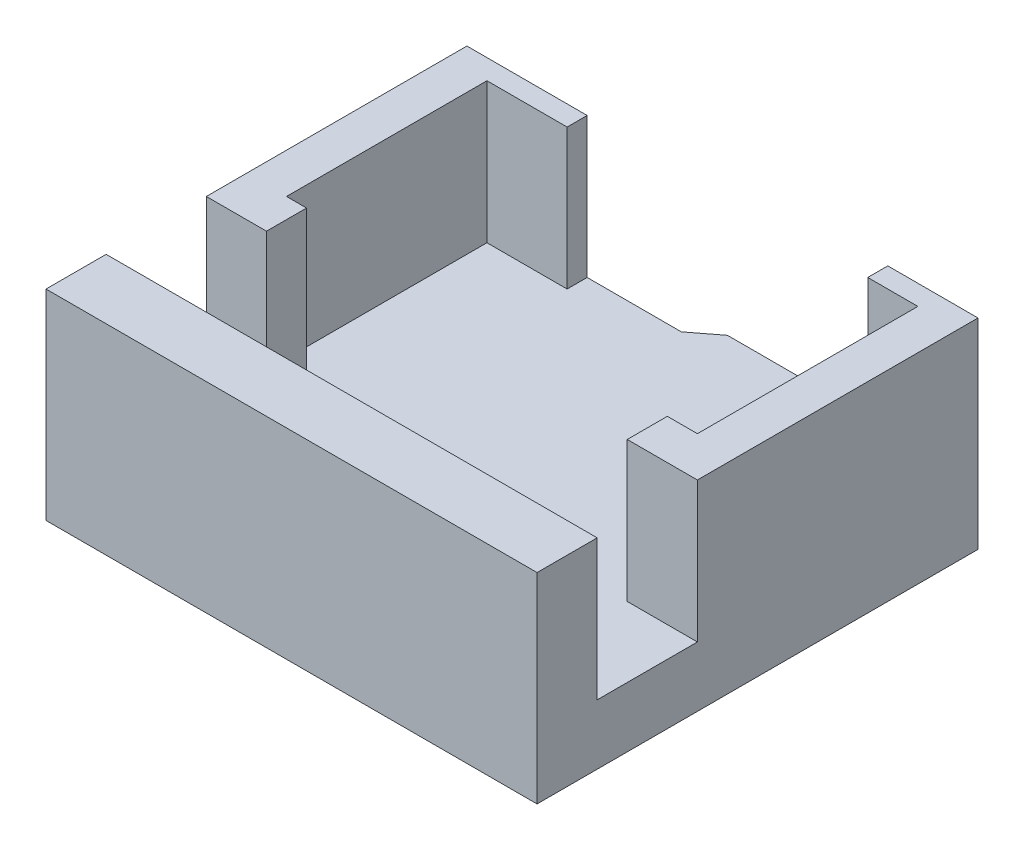
from build123d import *

# Parameters (mm, degrees)
BOSS_EXTRUDE1_DEPTH   = 7
BOSS_EXTRUDE1_2_DEPTH = 7
BOSS_EXTRUDE2_DEPTH   = 2
SKETCH4_W             = 14
SKETCH4_H             = 9
BOSS_EXTRUDE3_DEPTH   = 0.5
SKETCH5_W             = 11
SKETCH5_H             = 7
CUT_EXTRUDE1_DEPTH    = 0.5
SKETCH6_W             = 24.5
SKETCH6_H             = 2
BOSS_EXTRUDE4_DEPTH   = 8
SKETCH7_W             = 24.5
SKETCH7_H             = 3
BOSS_EXTRUDE5_DEPTH   = 7
BOSS_EXTRUDE6_DEPTH   = 1


with BuildPart() as part:
    # Sketch1 → Boss-Extrude1 (new body)
    with BuildSketch(Plane(origin=(0, 0, 0), x_dir=(1, 0, 0), z_dir=(0, 1, 0))):
        Polygon((-38.972010623, -19.234572985), (-37.972010623, -19.234572985), (-37.972010623, -21.234572985), (-40.972010623, -21.234572985), (-40.972010623, -8.234572985), (-34.972010623, -8.234572985), (-34.972010623, -9.234572985), (-38.972010623, -9.234572985), align=None)
    extrude(amount=BOSS_EXTRUDE1_DEPTH)



with BuildPart() as body_2:
    # Sketch1 → Boss-Extrude1 2 (new body)
    with BuildSketch(Plane(origin=(0, 0, 0), x_dir=(1, 0, 0), z_dir=(0, 1, 0))):
        Polygon((-18.972010623, -19.234572985), (-18.972010623, -8.234572985), (-20.972010623, -8.234572985), (-20.972010623, -7.234572985), (-16.972010623, -7.234572985), (-16.972010623, -21.234572985), (-19.972010623, -21.234572985), (-19.972010623, -19.234572985), align=None)
    extrude(amount=BOSS_EXTRUDE1_2_DEPTH)


with BuildPart() as part_1:
    add(part.part)

    add(body_2.part)  # Boss-Extrude2 merges body 2
    # Sketch2 → Boss-Extrude2 (add)
    with BuildSketch(Plane.XZ):
        Polygon((-40.972010623, 21.234572985), (-16.972010623, 21.234572985), (-16.972010623, 7.234572985), (-28.972010623, 7.234572985), (-30.273567276, 8.234572985), (-40.972010623, 8.234572985), align=None)
    extrude(amount=BOSS_EXTRUDE2_DEPTH)

    # Sketch4 → Boss-Extrude3 (add)
    with BuildSketch(Plane(origin=(-16.972010623, 0, 0), x_dir=(0, 0, -1), z_dir=(1, 0, 0))):
        with Locations((-14.234572985, 2.5)):
            Rectangle(SKETCH4_W, SKETCH4_H)
    extrude(amount=BOSS_EXTRUDE3_DEPTH)

    # Sketch5 → Cut-Extrude1 (cut)
    with BuildSketch(Plane.ZY.offset(18.972010623)):
        with Locations((13.734572985, 3.5)):
            Rectangle(SKETCH5_W, SKETCH5_H)
    extrude(amount=-CUT_EXTRUDE1_DEPTH, mode=Mode.SUBTRACT)

    # Sketch6 → Boss-Extrude4 (add)
    with BuildSketch(Plane.XY.offset(21.234572985)):
        with Locations((-28.722010623, -1)):
            Rectangle(SKETCH6_W, SKETCH6_H)
    extrude(amount=BOSS_EXTRUDE4_DEPTH)

    # Sketch7 → Boss-Extrude5 (add)
    with BuildSketch(Plane(origin=(0, 0, 0), x_dir=(1, 0, 0), z_dir=(0, 1, 0))):
        with Locations((-28.722010623, -27.734572985)):
            Rectangle(SKETCH7_W, SKETCH7_H)
    extrude(amount=BOSS_EXTRUDE5_DEPTH)

    # Sketch8 → Boss-Extrude6 (add)
    with BuildSketch(Plane.XZ.offset(2)):
        Polygon((-40.972010623, 29.234572985), (-40.972010623, 8.234572985), (-30.273567276, 8.234572985), (-28.972010623, 7.234572985), (-16.472010623, 7.234572985), (-16.472010623, 29.234572985), align=None)
    extrude(amount=BOSS_EXTRUDE6_DEPTH)


solid = part_1.part
